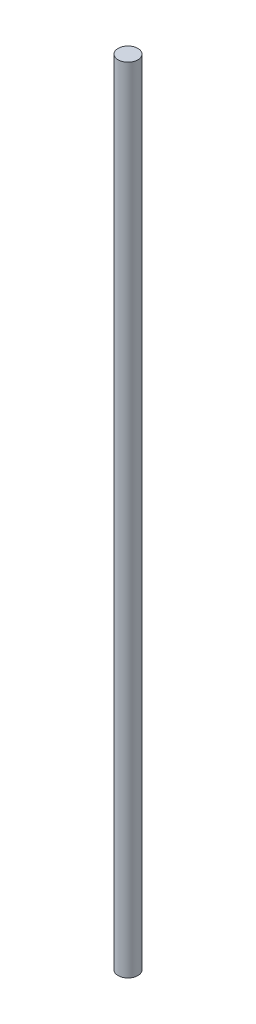
from build123d import *

# Parameters (mm, degrees)
SKETCH1_R           = 2.5
BOSS_EXTRUDE1_DEPTH = 200


with BuildPart() as part:
    # Sketch1 → Boss-Extrude1 (new body)
    with BuildSketch(Plane(origin=(0, 0, 0), x_dir=(1, 0, 0), z_dir=(0, 1, 0))):
        with Locations(Location((0, 0, 0), (0, 0, 270))):
            Circle(SKETCH1_R)
    extrude(amount=BOSS_EXTRUDE1_DEPTH)


solid = part.part
